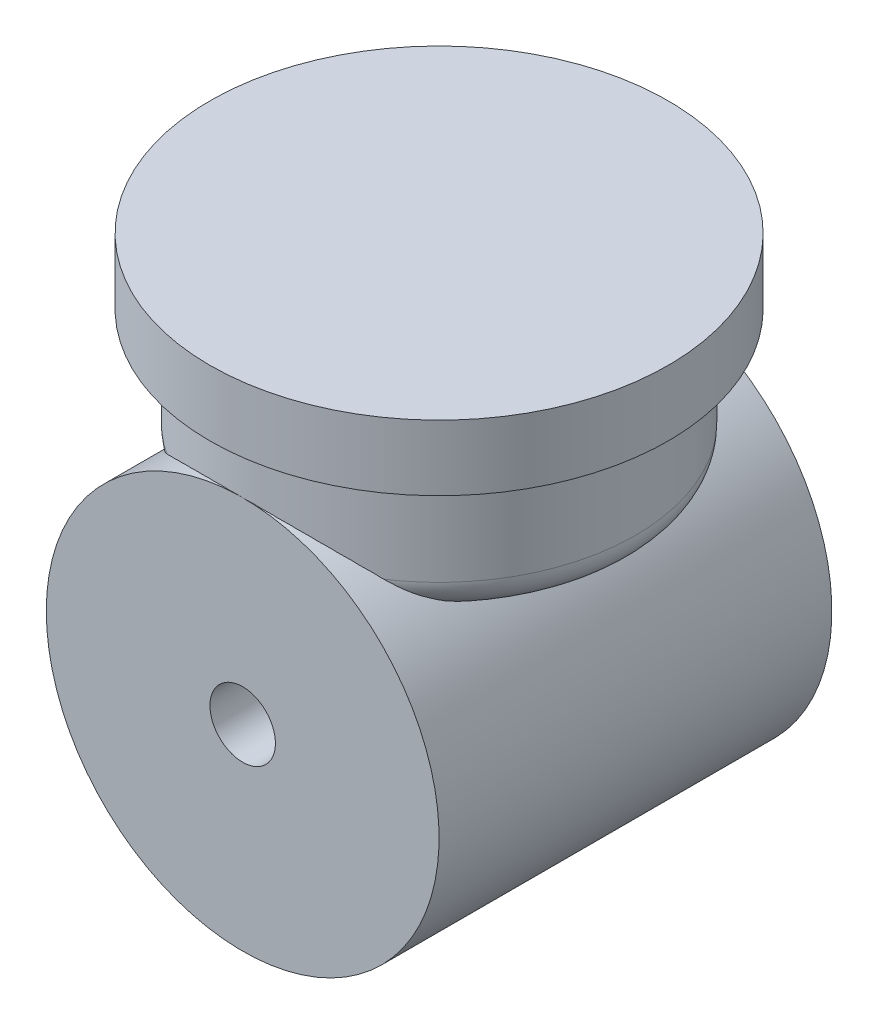
from build123d import *

# Parameters (mm, degrees)
SKETCH1_R           = 30
BOSS_EXTRUDE1_DEPTH = 20
SKETCH2_R           = 35
BOSS_EXTRUDE2_DEPTH = 10
SKETCH3_R           = 30
BOSS_EXTRUDE3_DEPTH = 30
SKETCH4_R           = 5
CUT_EXTRUDE1_DEPTH  = 90.162772501
RACCORDO1_R         = 5


with BuildPart() as part:
    # Sketch1 → Boss-Extrude1 (new body)
    with BuildSketch(Plane(origin=(0, 0, 0), x_dir=(1, 0, 0), z_dir=(0, 1, 0))):
        with Locations(Location((0, 0, 0), (0, 0, 270))):
            Circle(SKETCH1_R)
    extrude(amount=BOSS_EXTRUDE1_DEPTH)

    # Sketch2 → Boss-Extrude2 (add)
    with BuildSketch(Plane(origin=(0, 20, 0), x_dir=(1, 0, 0), z_dir=(0, 1, 0))):
        with Locations(Location((0, 0, 0), (0, 0, 270))):
            Circle(SKETCH2_R)
    extrude(amount=BOSS_EXTRUDE2_DEPTH)

    # Raccordo1
    raccordo1_edges = [part.edges().sort_by_distance(p)[0] for p in [
        (0, 0, -30),
    ]]
    fillet(raccordo1_edges, radius=RACCORDO1_R)


with BuildPart() as body_2:
    # Sketch3 → Boss-Extrude3 (new, symmetric)
    with BuildSketch(Plane(origin=(0, 0, 0), x_dir=(-1, 0, 0), z_dir=(0, 0, -1))):
        with Locations((0, -20)):
            Circle(SKETCH3_R)
    extrude(amount=BOSS_EXTRUDE3_DEPTH, both=True)

    # Sketch4 → Cut-Extrude1 (cut, through all)
    with BuildSketch(Plane(origin=(0, 0, -30), x_dir=(-1, 0, 0), z_dir=(0, 0, -1))):
        with Locations((0, -20)):
            Circle(SKETCH4_R)
    extrude(amount=-CUT_EXTRUDE1_DEPTH, mode=Mode.SUBTRACT)


solid = Compound([part.part, body_2.part])
